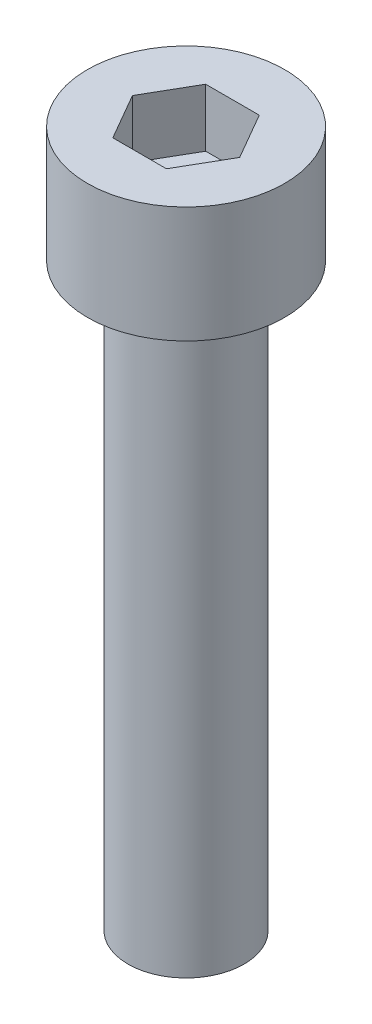
from build123d import *

# Parameters (mm, degrees)
CUT_EXTRUDE1_DEPTH = 2.5


with BuildPart() as part:
    # Sketch1 → Revolve1 (revolve)
    with BuildSketch(Plane.XY, mode=Mode.PRIVATE) as revolve1_sk:
        Polygon((0, 0), (2.5, 0), (2.5, 25), (4.25, 25), (4.25, 30), (0, 30), align=None)
    revolve(revolve1_sk.sketch.rotate(Axis((0, 30, 0), (0, -1, 0)), 90), axis=Axis((0, 30, 0), (0, -1, 0)))

    # Sketch2 → Cut-Extrude1 (cut)
    with BuildSketch(Plane(origin=(0, 30, 0), x_dir=(1, 0, 0), z_dir=(0, 1, 0))):
        Polygon((1.154700538, 2), (-1.154700538, 2), (-2.309401077, 0), (-1.154700538, -2), (1.154700538, -2), (2.309401077, 0), align=None)
    extrude(amount=-CUT_EXTRUDE1_DEPTH, mode=Mode.SUBTRACT)


solid = part.part
